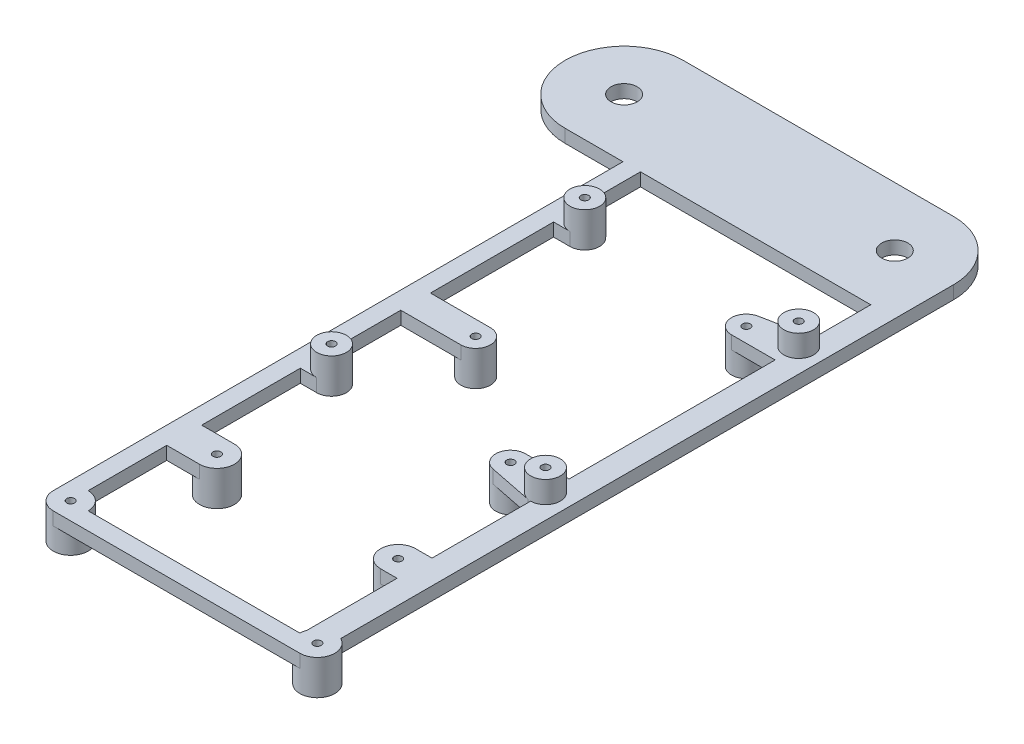
from build123d import *

# Parameters (mm, degrees)
SKETCH2_R                       = 3
SHIFTER_HOLE_IF_DEPTH           = 3
RPI4_SCREW_BOSSES_DEPTH         = 5
RPI4_SCREW_BOSSES_DEPTH_BACK    = 3
SKETCH3_R                       = 3.4
SKETCH3_R_2                     = 0.9
RPI4_SCREW_BOSSES_2_DEPTH       = 5
RPI4_SCREW_BOSSES_2_DEPTH_BACK  = 3
RPI4_SCREW_BOSSES_3_DEPTH       = 5
RPI4_SCREW_BOSSES_3_DEPTH_BACK  = 3
RPI4_SCREW_BOSSES_4_DEPTH       = 5
RPI4_SCREW_BOSSES_4_DEPTH_BACK  = 3
SKETCH4_R                       = 3.4
SKETCH4_R_2                     = 0.9
CAN_SWITCH_SCREW_BOSSES_DEPTH   = 8
CAN_SWITCH_SCREW_BOSSES_2_DEPTH = 8
CAN_SWITCH_SCREW_BOSSES_3_DEPTH = 8
SKETCH5_R                       = 4
SKETCH5_R_2                     = 0.9
F_5V_REG_MOUNT_POSTS_DEPTH      = 8
F_5V_REG_MOUNT_POSTS_2_DEPTH    = 8
F_5V_REG_MOUNT_POSTS_3_DEPTH    = 8
F_5V_REG_MOUNT_POSTS_4_DEPTH    = 8
SKETCH6_R                       = 0.9
IF_LINK_DEPTH                   = 3
CUT_EXTRUDE1_DEPTH              = 125.251760551
CUT_EXTRUDE1_DEPTH_BACK         = 125.251760551


with BuildPart() as part:
    # Sketch2 → SHIFTER HOLE IF (new body)
    with BuildSketch(Plane(origin=(0, -50.5, 0), x_dir=(1, 0, 0), z_dir=(0, 1, 0))):
        with BuildLine():
            Line((-50, 106.5), (12, 106.5))
            ThreePointArc((12, 106.5), (25.5, 93), (12, 79.5))
            Line((12, 79.5), (-50, 79.5))
            ThreePointArc((-50, 79.5), (-63.5, 93), (-50, 106.5))
        make_face()
        with Locations(Location((-50, 93, 0), (0, 0, 270))):
            Circle(SKETCH2_R, mode=Mode.SUBTRACT)
        with Locations(Location((12, 93, 0), (0, 0, 270))):
            Circle(SKETCH2_R, mode=Mode.SUBTRACT)
    extrude(amount=-SHIFTER_HOLE_IF_DEPTH)



with BuildPart() as body_2:
    # Sketch3 → RPI4 SCREW BOSSES (new, two sides: drawn at the far end of the back side and taken through both)
    with BuildSketch(Plane(origin=(0, -50.5, 0), x_dir=(1, 0, 0), z_dir=(0, 1, 0)).offset(-RPI4_SCREW_BOSSES_DEPTH_BACK)):
        with Locations(Location((-29, 63, 0), (0, 0, 270))):
            Circle(SKETCH3_R)
        with Locations(Location((-29, 63, 0), (0, 0, 270))):
            Circle(SKETCH3_R_2, mode=Mode.SUBTRACT)
    extrude(amount=RPI4_SCREW_BOSSES_DEPTH + RPI4_SCREW_BOSSES_DEPTH_BACK)


with BuildPart() as body_3:
    # Sketch3 → RPI4 SCREW BOSSES 2 (new, two sides: drawn at the far end of the back side and taken through both)
    with BuildSketch(Plane(origin=(0, -50.5, 0), x_dir=(1, 0, 0), z_dir=(0, 1, 0)).offset(-RPI4_SCREW_BOSSES_2_DEPTH_BACK)):
        with Locations(Location((20, 63, 0), (0, 0, 270))):
            Circle(SKETCH3_R)
        with Locations(Location((20, 63, 0), (0, 0, 270))):
            Circle(SKETCH3_R_2, mode=Mode.SUBTRACT)
    extrude(amount=RPI4_SCREW_BOSSES_2_DEPTH + RPI4_SCREW_BOSSES_2_DEPTH_BACK)


with BuildPart() as body_4:
    # Sketch3 → RPI4 SCREW BOSSES 3 (new, two sides: drawn at the far end of the back side and taken through both)
    with BuildSketch(Plane(origin=(0, -50.5, 0), x_dir=(1, 0, 0), z_dir=(0, 1, 0)).offset(-RPI4_SCREW_BOSSES_3_DEPTH_BACK)):
        with Locations(Location((20, 5, 0), (0, 0, 270))):
            Circle(SKETCH3_R)
        with Locations(Location((20, 5, 0), (0, 0, 270))):
            Circle(SKETCH3_R_2, mode=Mode.SUBTRACT)
    extrude(amount=RPI4_SCREW_BOSSES_3_DEPTH + RPI4_SCREW_BOSSES_3_DEPTH_BACK)


with BuildPart() as body_5:
    # Sketch3 → RPI4 SCREW BOSSES 4 (new, two sides: drawn at the far end of the back side and taken through both)
    with BuildSketch(Plane(origin=(0, -50.5, 0), x_dir=(1, 0, 0), z_dir=(0, 1, 0)).offset(-RPI4_SCREW_BOSSES_4_DEPTH_BACK)):
        with Locations(Location((-29, 5, 0), (0, 0, 270))):
            Circle(SKETCH3_R)
        with Locations(Location((-29, 5, 0), (0, 0, 270))):
            Circle(SKETCH3_R_2, mode=Mode.SUBTRACT)
    extrude(amount=RPI4_SCREW_BOSSES_4_DEPTH + RPI4_SCREW_BOSSES_4_DEPTH_BACK)


with BuildPart() as body_6:
    # Sketch4 → CAN SWITCH SCREW BOSSES (new body)
    with BuildSketch(Plane(origin=(0, -50.5, 0), x_dir=(1, 0, 0), z_dir=(0, 1, 0))):
        with Locations(Location((10, 61, 0), (0, 0, 270))):
            Circle(SKETCH4_R)
        with Locations(Location((10, 61, 0), (0, 0, 270))):
            Circle(SKETCH4_R_2, mode=Mode.SUBTRACT)
    extrude(amount=-CAN_SWITCH_SCREW_BOSSES_DEPTH)


with BuildPart() as body_7:
    # Sketch4 → CAN SWITCH SCREW BOSSES 2 (new body)
    with BuildSketch(Plane(origin=(0, -50.5, 0), x_dir=(1, 0, 0), z_dir=(0, 1, 0))):
        with Locations(Location((10, 7, 0), (0, 0, 270))):
            Circle(SKETCH4_R)
        with Locations(Location((10, 7, 0), (0, 0, 270))):
            Circle(SKETCH4_R_2, mode=Mode.SUBTRACT)
    extrude(amount=-CAN_SWITCH_SCREW_BOSSES_2_DEPTH)


with BuildPart() as body_8:
    # Sketch4 → CAN SWITCH SCREW BOSSES 3 (new body)
    with BuildSketch(Plane(origin=(0, -50.5, 0), x_dir=(1, 0, 0), z_dir=(0, 1, 0))):
        with Locations(Location((-19, 28, 0), (0, 0, 270))):
            Circle(SKETCH4_R)
        with Locations(Location((-19, 28, 0), (0, 0, 270))):
            Circle(SKETCH4_R_2, mode=Mode.SUBTRACT)
    extrude(amount=-CAN_SWITCH_SCREW_BOSSES_3_DEPTH)


with BuildPart() as body_9:
    # Sketch5 → 5V REG MOUNT POSTS (new body)
    with BuildSketch(Plane(origin=(0, -50.5, 0), x_dir=(1, 0, 0), z_dir=(0, 1, 0))):
        with Locations(Location((-32.75, -51, 0), (0, 0, 270))):
            Circle(SKETCH5_R)
        with Locations(Location((-32.75, -51, 0), (0, 0, 270))):
            Circle(SKETCH5_R_2, mode=Mode.SUBTRACT)
    extrude(amount=-F_5V_REG_MOUNT_POSTS_DEPTH)


with BuildPart() as body_10:
    # Sketch5 → 5V REG MOUNT POSTS 2 (new body)
    with BuildSketch(Plane(origin=(0, -50.5, 0), x_dir=(1, 0, 0), z_dir=(0, 1, 0))):
        with Locations(Location((-25.25, -25, 0), (0, 0, 270))):
            Circle(SKETCH5_R)
        with Locations(Location((-25.25, -25, 0), (0, 0, 270))):
            Circle(SKETCH5_R_2, mode=Mode.SUBTRACT)
    extrude(amount=-F_5V_REG_MOUNT_POSTS_2_DEPTH)


with BuildPart() as body_11:
    # Sketch5 → 5V REG MOUNT POSTS 3 (new body)
    with BuildSketch(Plane(origin=(0, -50.5, 0), x_dir=(1, 0, 0), z_dir=(0, 1, 0))):
        with Locations(Location((16.25, -25, 0), (0, 0, 270))):
            Circle(SKETCH5_R)
        with Locations(Location((16.25, -25, 0), (0, 0, 270))):
            Circle(SKETCH5_R_2, mode=Mode.SUBTRACT)
    extrude(amount=-F_5V_REG_MOUNT_POSTS_3_DEPTH)


with BuildPart() as body_12:
    # Sketch5 → 5V REG MOUNT POSTS 4 (new body)
    with BuildSketch(Plane(origin=(0, -50.5, 0), x_dir=(1, 0, 0), z_dir=(0, 1, 0))):
        with Locations(Location((23.75, -51, 0), (0, 0, 270))):
            Circle(SKETCH5_R)
        with Locations(Location((23.75, -51, 0), (0, 0, 270))):
            Circle(SKETCH5_R_2, mode=Mode.SUBTRACT)
    extrude(amount=-F_5V_REG_MOUNT_POSTS_4_DEPTH)


with BuildPart() as part_1:
    add(part.part)

    add(body_2.part)  # IF LINK merges body 2

    add(body_3.part)  # IF LINK merges body 3

    add(body_4.part)  # IF LINK merges body 4

    add(body_5.part)  # IF LINK merges body 5

    add(body_6.part)  # IF LINK merges body 6

    add(body_7.part)  # IF LINK merges body 7

    add(body_8.part)  # IF LINK merges body 8

    add(body_9.part)  # IF LINK merges body 9

    add(body_10.part)  # IF LINK merges body 10

    add(body_11.part)  # IF LINK merges body 11

    add(body_12.part)  # IF LINK merges body 12
    # Sketch6 → IF LINK (add)
    with BuildSketch(Plane(origin=(0, -50.5, 0), x_dir=(1, 0, 0), z_dir=(0, 1, 0))):
        with BuildLine():
            Line((25.5, 93), (25.5, -47.403126358))
            ThreePointArc((25.5, -47.403126358), (27.647915762, -51.897915762), (23.75, -55))
            Line((23.75, -55), (-32.75, -55))
            ThreePointArc((-32.75, -55), (-35.578427125, -53.828427125), (-36.75, -51))
            Line((-36.75, -51), (-36.75, 79.5))
            Line((-36.75, 79.5), (12, 79.5))
            ThreePointArc((12, 79.5), (21.545941546, 83.454058454), (25.5, 93))
        make_face()
        with Locations(Location((-25.25, -25, 0), (0, 0, 270))):
            Circle(SKETCH6_R, mode=Mode.SUBTRACT)
        with Locations(Location((16.25, -25, 0), (0, 0, 270))):
            Circle(SKETCH6_R, mode=Mode.SUBTRACT)
        with Locations(Location((23.75, -51, 0), (0, 0, 270))):
            Circle(SKETCH6_R, mode=Mode.SUBTRACT)
        with Locations(Location((-32.75, -51, 0), (0, 0, 270))):
            Circle(SKETCH6_R, mode=Mode.SUBTRACT)
        with Locations(Location((-29, 63, 0), (0, 0, 270))):
            Circle(SKETCH6_R, mode=Mode.SUBTRACT)
        with Locations(Location((20, 63, 0), (0, 0, 270))):
            Circle(SKETCH6_R, mode=Mode.SUBTRACT)
        with Locations(Location((10, 61, 0), (0, 0, 270))):
            Circle(SKETCH6_R, mode=Mode.SUBTRACT)
        with Locations(Location((-19, 28, 0), (0, 0, 270))):
            Circle(SKETCH6_R, mode=Mode.SUBTRACT)
        with Locations(Location((10, 7, 0), (0, 0, 270))):
            Circle(SKETCH6_R, mode=Mode.SUBTRACT)
        with Locations(Location((20, 5, 0), (0, 0, 270))):
            Circle(SKETCH6_R, mode=Mode.SUBTRACT)
        with Locations(Location((-29, 5, 0), (0, 0, 270))):
            Circle(SKETCH6_R, mode=Mode.SUBTRACT)
    extrude(amount=-IF_LINK_DEPTH)

    # Sketch7 → Cut-Extrude1 (cut, two sides: drawn at the far end of the back side and taken through both)
    with BuildSketch(Plane(origin=(0, -50.5, 0), x_dir=(1, 0, 0), z_dir=(0, 1, 0)).offset(-CUT_EXTRUDE1_DEPTH_BACK)):
        with BuildLine():
            Line((-32.75, 66.4), (-32.75, 79.5))
            Line((-32.75, 79.5), (20, 79.5))
            Line((20, 79.5), (20, 66.4))
            ThreePointArc((20, 66.4), (19.664972099, 66.383453311), (19.333205141, 66.333974297))
            Line((19.333205141, 66.333974297), (9.333205141, 64.333974297))
            ThreePointArc((9.333205141, 64.333974297), (6.616546689, 60.664972099), (10, 57.6))
            Line((10, 57.6), (20, 57.6))
            Line((20, 57.6), (20, 10.4))
            Line((20, 10.4), (10, 10.4))
            ThreePointArc((10, 10.4), (6.616546689, 7.335027901), (9.333205141, 3.666025703))
            Line((9.333205141, 3.666025703), (19.333205141, 1.666025703))
            ThreePointArc((19.333205141, 1.666025703), (19.664972099, 1.616546689), (20, 1.6))
            Line((20, 1.6), (20, -21))
            Line((20, -21), (16.25, -21))
            ThreePointArc((16.25, -21), (12.25, -25), (16.25, -29))
            Line((16.25, -29), (20, -29))
            Line((20, -29), (20, -49.608058909))
            ThreePointArc((20, -49.608058909), (19.812996063, -50.292893219), (19.75, -51))
            Line((19.75, -51), (-28.75, -51))
            ThreePointArc((-28.75, -51), (-29.921572875, -48.171572875), (-32.75, -47))
            Line((-32.75, -47), (-32.75, -29))
            Line((-32.75, -29), (-25.25, -29))
            ThreePointArc((-25.25, -29), (-21.25, -25), (-25.25, -21))
            Line((-25.25, -21), (-32.75, -21))
            Line((-32.75, -21), (-32.75, 1.6))
            Line((-32.75, 1.6), (-29, 1.6))
            ThreePointArc((-29, 1.6), (-25.6, 5), (-29, 8.4))
            Line((-29, 8.4), (-32.75, 8.4))
            Line((-32.75, 8.4), (-32.75, 24.6))
            Line((-32.75, 24.6), (-19, 24.6))
            ThreePointArc((-19, 24.6), (-15.6, 28), (-19, 31.4))
            Line((-19, 31.4), (-32.75, 31.4))
            Line((-32.75, 31.4), (-32.75, 59.6))
            Line((-32.75, 59.6), (-29, 59.6))
            ThreePointArc((-29, 59.6), (-25.6, 63), (-29, 66.4))
            Line((-29, 66.4), (-32.75, 66.4))
        make_face()
    extrude(amount=CUT_EXTRUDE1_DEPTH + CUT_EXTRUDE1_DEPTH_BACK, mode=Mode.SUBTRACT)


solid = part_1.part
